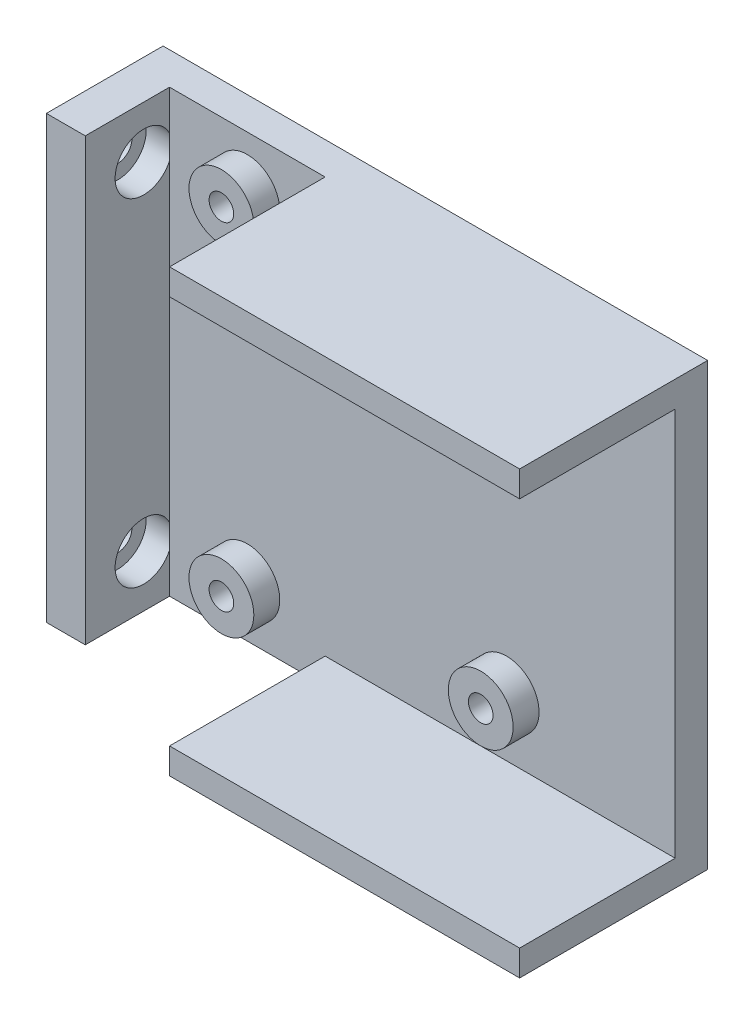
from build123d import *

# Parameters (mm, degrees)
SKETCH1_W                     = 42
SKETCH1_H                     = 34
BOSS_EXTRUDE1_DEPTH           = 2.5
BOSS_EXTRUDE2_DEPTH           = 12
SKETCH3_W                     = 12
SKETCH3_H                     = 34
CUT_EXTRUDE1_DEPTH            = 12
CBORE_FOR_M2_SHCS1_AT_2_COUNT = 2
CBORE_FOR_M2_SHCS1_AT_2_PITCH = 26
SKETCH8_W                     = 3
SKETCH8_H                     = 34
CUT_EXTRUDE2_DEPTH            = 5.5
SKETCH9_R                     = 2.5
BOSS_EXTRUDE3_DEPTH           = 2
SKETCH10_R                    = 0.95
CUT_EXTRUDE3_DEPTH            = 4.5


with BuildPart() as part:
    # Sketch1 → Boss-Extrude1 (new body)
    with BuildSketch(Plane.XY):
        with Locations((21, 17)):
            Rectangle(SKETCH1_W, SKETCH1_H)
    extrude(amount=BOSS_EXTRUDE1_DEPTH)

    # Sketch2 → Boss-Extrude2 (add)
    with BuildSketch(Plane.XY.offset(2.5)):
        Polygon((0, 34), (42, 34), (42, 32), (3, 32), (3, 2), (42, 2), (42, 0), (0, 0), align=None)
    extrude(amount=BOSS_EXTRUDE2_DEPTH)

    # Sketch3 → Cut-Extrude1 (cut)
    with BuildSketch(Plane.XY.offset(14.5)):
        with Locations((9, 17)):
            Rectangle(SKETCH3_W, SKETCH3_H)
    extrude(amount=-CUT_EXTRUDE1_DEPTH, mode=Mode.SUBTRACT)

    # Sketch5 → CBORE for M2 SHCS1 (revolve, cut)
    with BuildSketch(Plane(origin=(3, 4, 4.5), x_dir=(0, 0, -1), z_dir=(0, 1, 0))):
        Polygon((0, 0), (0, 3), (1.1, 3), (1.1, 2), (2.2, 2), (2.2, 0), align=None)
    cbore_for_m2_shcs1 = revolve(axis=Axis((9.35, 4, 4.5), (-1, 0, 0)), mode=Mode.SUBTRACT)

    # CBORE for M2 SHCS1 at 2: CBORE for M2 SHCS1 ×2
    with Locations(*[(0, i * CBORE_FOR_M2_SHCS1_AT_2_PITCH, 0) for i in range(1, CBORE_FOR_M2_SHCS1_AT_2_COUNT)]):
        add(cbore_for_m2_shcs1, mode=Mode.SUBTRACT)

    # Sketch8 → Cut-Extrude2 (cut)
    with BuildSketch(Plane.XY.offset(14.5)):
        with Locations((1.5, 17)):
            Rectangle(SKETCH8_W, SKETCH8_H)
    extrude(amount=-CUT_EXTRUDE2_DEPTH, mode=Mode.SUBTRACT)

    # Sketch9 → Boss-Extrude3 (add)
    with BuildSketch(Plane.XY.offset(2.5)):
        with Locations(Location((9, 30, 0), (0, 0, 180))):
            Circle(SKETCH9_R)
        with Locations(Location((9, 4, 0), (0, 0, 180))):
            Circle(SKETCH9_R)
        with Locations(Location((29, 27.5, 0), (0, 0, 180))):
            Circle(SKETCH9_R)
        with Locations(Location((29, 6.5, 0), (0, 0, 180))):
            Circle(SKETCH9_R)
    extrude(amount=BOSS_EXTRUDE3_DEPTH)

    # Sketch10 → Cut-Extrude3 (cut)
    with BuildSketch(Plane.XY.offset(4.5)):
        with Locations((9, 30)):
            Circle(SKETCH10_R)
        with Locations((9, 4)):
            Circle(SKETCH10_R)
        with Locations((29, 27.5)):
            Circle(SKETCH10_R)
        with Locations((29, 6.5)):
            Circle(SKETCH10_R)
    extrude(amount=-CUT_EXTRUDE3_DEPTH, mode=Mode.SUBTRACT)


solid = part.part
